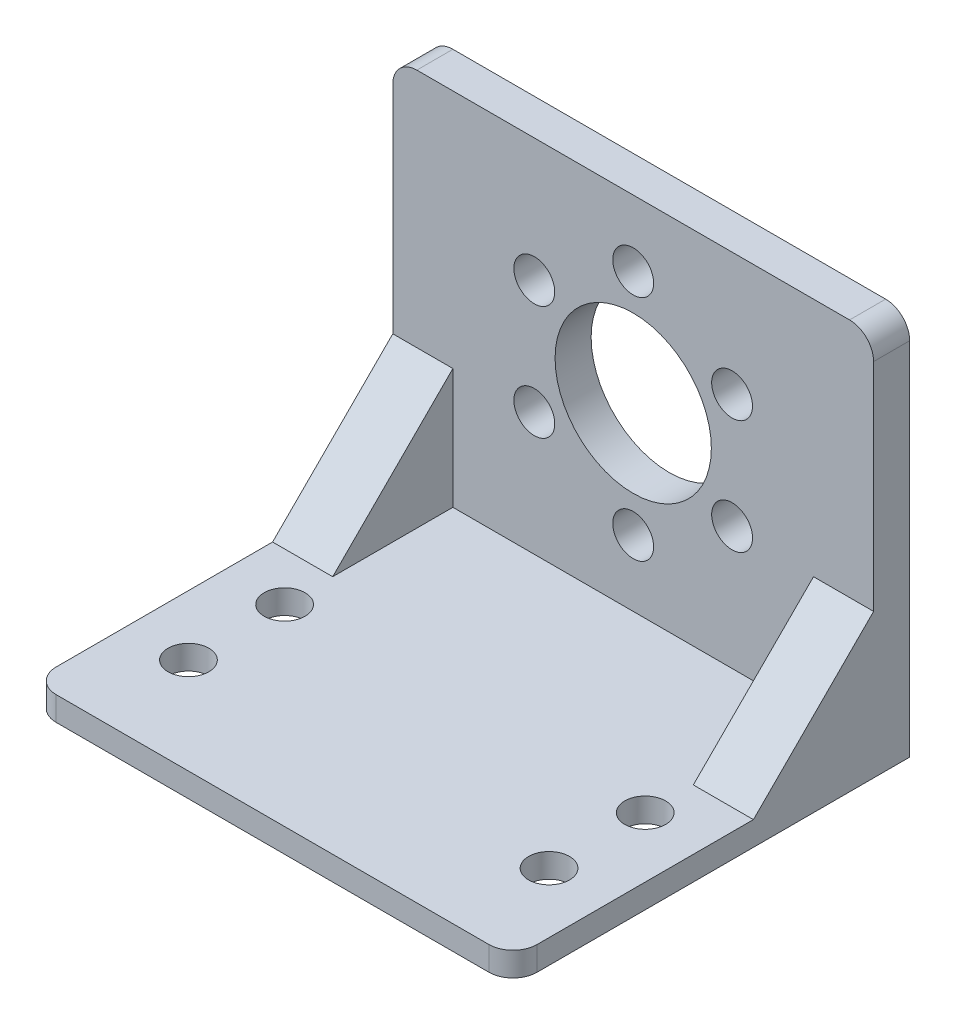
from build123d import *

# Parameters (mm, degrees)
SKETCH_2_W          = 40
SKETCH_2_H          = 32
SKETCH_2_R          = 1.7
EXTRUDE_2_DEPTH     = 3
CUT_EXTRUDE_1_REACH = 39.855
SKETCH_3_R          = 6.5
SKETCH_4_W          = 40
SKETCH_4_H          = 2
EXTRUDE_3_DEPTH     = 30
EXTRUDE_4_DEPTH     = 5
FILLET_1_R          = 2
SKETCH_6_R          = 1.7
CUT_EXTRUDE_2_DEPTH = 10


with BuildPart() as part:
    # 草图2 → 凸台-拉伸2 (new body)
    with BuildSketch(Plane.XY):
        with Locations((0, 16)):
            Rectangle(SKETCH_2_W, SKETCH_2_H)
        with Locations((0, 26.5)):
            Circle(SKETCH_2_R, mode=Mode.SUBTRACT)
        with Locations((8.227241336, 21.75)):
            Circle(SKETCH_2_R, mode=Mode.SUBTRACT)
        with Locations((8.227241336, 12.25)):
            Circle(SKETCH_2_R, mode=Mode.SUBTRACT)
        with Locations((0, 7.5)):
            Circle(SKETCH_2_R, mode=Mode.SUBTRACT)
        with Locations((-8.227241336, 12.25)):
            Circle(SKETCH_2_R, mode=Mode.SUBTRACT)
        with Locations((-8.227241336, 21.75)):
            Circle(SKETCH_2_R, mode=Mode.SUBTRACT)
    extrude(amount=EXTRUDE_2_DEPTH)

    # 草图3 → 切除-拉伸1 (cut, up to next)
    with BuildSketch(Plane.XY.offset(3), mode=Mode.PRIVATE) as cut_extrude_1_sk1:
        with Locations((0, 17)):
            Circle(SKETCH_3_R)
    cut_extrude_1_tool1 = extrude(cut_extrude_1_sk1.sketch, amount=-CUT_EXTRUDE_1_REACH, mode=Mode.PRIVATE) & part.part
    add(cut_extrude_1_tool1.solids().sort_by_distance((0, 17, 3))[0], mode=Mode.SUBTRACT)

    # 草图4 → 凸台-拉伸3 (add)
    with BuildSketch(Plane.XY.offset(3)):
        with Locations((0, 1)):
            Rectangle(SKETCH_4_W, SKETCH_4_H)
    extrude(amount=EXTRUDE_3_DEPTH)

    # 草图5 → 凸台-拉伸4 (add)
    with BuildSketch(Plane.ZY.offset(20)):
        Polygon((3, 12), (13, 2), (3, 2), align=None)
    extrude_4 = extrude(amount=-EXTRUDE_4_DEPTH)

    # 镜向1: 凸台-拉伸4 across plane
    add(extrude_4.mirror(Plane(origin=(0, 0, 0), x_dir=(0, 0, 1), z_dir=(1, 0, 0))))

    # 圆角1
    fillet_1_edges = [part.edges().sort_by_distance(p)[0] for p in [
        (-20, 1, 33),
        (20, 1, 33),
        (-20, 32, 1.5),
        (20, 32, 1.5),
    ]]
    fillet(fillet_1_edges, radius=FILLET_1_R)

    # 草图6 → 切除-拉伸2 (cut)
    with BuildSketch(Plane(origin=(0, 2, 0), x_dir=(1, 0, 0), z_dir=(0, 1, 0))):
        with Locations(Location((-15, -17, 0), (0, 0, 270))):
            Circle(SKETCH_6_R)
        with Locations(Location((15, -17, 0), (0, 0, 270))):
            Circle(SKETCH_6_R)
        with Locations(Location((-15, -25, 0), (0, 0, 270))):
            Circle(SKETCH_6_R)
        with Locations(Location((15, -25, 0), (0, 0, 270))):
            Circle(SKETCH_6_R)
    extrude(amount=-CUT_EXTRUDE_2_DEPTH, mode=Mode.SUBTRACT)


solid = part.part
